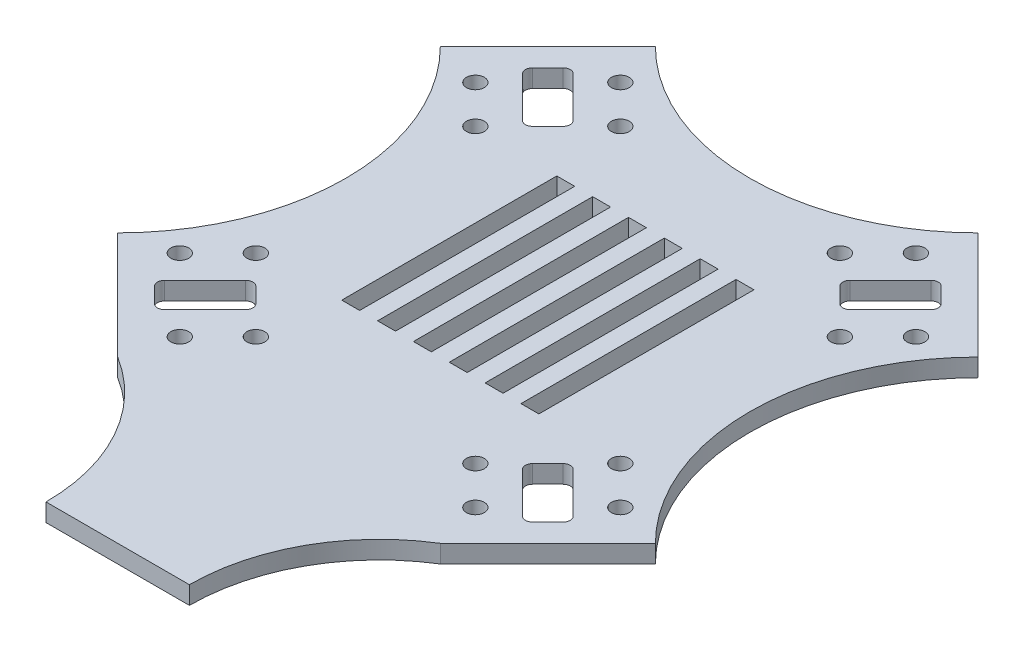
from build123d import *

# Parameters (mm, degrees)
SKETCH2_R           = 2.5
SKETCH2_W           = 5
SKETCH2_H           = 60
BOSS_EXTRUDE1_DEPTH = 5
BOSS_EXTRUDE2_DEPTH = 5


with BuildPart() as part:
    # Sketch2 → Boss-Extrude1 (new body)
    with BuildSketch(Plane(origin=(0, 0, 0), x_dir=(1, 0, 0), z_dir=(0, 1, 0))):
        with BuildLine():
            Line((45, 75), (75, 45))
            ThreePointArc((75, 45), (56.360389693, 0), (75, -45))
            Line((75, -45), (45, -75))
            ThreePointArc((45, -75), (0, -56.360389693), (-45, -75))
            Line((-45, -75), (-75, -45))
            ThreePointArc((-75, -45), (-56.360389693, 0), (-75, 45))
            Line((-75, 45), (-45, 75))
            ThreePointArc((-45, 75), (0, 56.360389693), (45, 75))
        make_face()
        with Locations(Location((50.841633347, 30.621504688, 0), (0, 0, 270))):
            Circle(SKETCH2_R, mode=Mode.SUBTRACT)
        with Locations(Location((61.448235065, 41.228106405, 0), (0, 0, 270))):
            Circle(SKETCH2_R, mode=Mode.SUBTRACT)
        with Locations(Location((30.621504688, 50.841633347, 0), (0, 0, 90))):
            Circle(SKETCH2_R, mode=Mode.SUBTRACT)
        with Locations(Location((41.228106405, 61.448235065, 0), (0, 0, 90))):
            Circle(SKETCH2_R, mode=Mode.SUBTRACT)
        with Locations(Location((30.621504688, -50.841633347, 0), (0, 0, 270))):
            Circle(SKETCH2_R, mode=Mode.SUBTRACT)
        with Locations(Location((41.228106405, -61.448235065, 0), (0, 0, 270))):
            Circle(SKETCH2_R, mode=Mode.SUBTRACT)
        with Locations(Location((61.448235065, -41.228106405, 0), (0, 0, 90))):
            Circle(SKETCH2_R, mode=Mode.SUBTRACT)
        with Locations(Location((50.841633347, -30.621504688, 0), (0, 0, 90))):
            Circle(SKETCH2_R, mode=Mode.SUBTRACT)
        with Locations(Location((-50.841633347, -30.621504688, 0), (0, 0, 270))):
            Circle(SKETCH2_R, mode=Mode.SUBTRACT)
        with Locations(Location((-61.448235065, -41.228106405, 0), (0, 0, 270))):
            Circle(SKETCH2_R, mode=Mode.SUBTRACT)
        with Locations(Location((-41.228106405, -61.448235065, 0), (0, 0, 90))):
            Circle(SKETCH2_R, mode=Mode.SUBTRACT)
        with Locations(Location((-30.621504688, -50.841633347, 0), (0, 0, 90))):
            Circle(SKETCH2_R, mode=Mode.SUBTRACT)
        with Locations(Location((-30.621504688, 50.841633347, 0), (0, 0, 270))):
            Circle(SKETCH2_R, mode=Mode.SUBTRACT)
        with Locations(Location((-41.228106405, 61.448235065, 0), (0, 0, 270))):
            Circle(SKETCH2_R, mode=Mode.SUBTRACT)
        with Locations(Location((-61.448235065, 41.228106405, 0), (0, 0, 90))):
            Circle(SKETCH2_R, mode=Mode.SUBTRACT)
        with Locations(Location((-50.841633347, 30.621504688, 0), (0, 0, 90))):
            Circle(SKETCH2_R, mode=Mode.SUBTRACT)
        with BuildLine():
            Line((38.610248674, 42.852889361), (42.852889361, 38.610248674))
            ThreePointArc((42.852889361, 38.610248674), (44.267102923, 38.024462236), (45.681316486, 38.610248674))
            Line((45.681316486, 38.610248674), (56.995024985, 49.923957173))
            ThreePointArc((56.995024985, 49.923957173), (57.580811422, 51.338170735), (56.995024985, 52.752384297))
            Line((56.995024985, 52.752384297), (52.752384297, 56.995024985))
            ThreePointArc((52.752384297, 56.995024985), (51.338170735, 57.580811422), (49.923957173, 56.995024985))
            Line((49.923957173, 56.995024985), (38.610248674, 45.681316486))
            ThreePointArc((38.610248674, 45.681316486), (38.024462236, 44.267102923), (38.610248674, 42.852889361))
        make_face(mode=Mode.SUBTRACT)
        with Locations((5, 0)):
            Rectangle(SKETCH2_W, SKETCH2_H, mode=Mode.SUBTRACT)
        with Locations((-5, 0)):
            Rectangle(SKETCH2_W, SKETCH2_H, mode=Mode.SUBTRACT)
        with BuildLine():
            Line((45.681316486, -38.610248674), (56.995024985, -49.923957173))
            ThreePointArc((56.995024985, -49.923957173), (57.580811422, -51.338170735), (56.995024985, -52.752384297))
            Line((56.995024985, -52.752384297), (52.752384297, -56.995024985))
            ThreePointArc((52.752384297, -56.995024985), (51.338170735, -57.580811422), (49.923957173, -56.995024985))
            Line((49.923957173, -56.995024985), (38.610248674, -45.681316486))
            ThreePointArc((38.610248674, -45.681316486), (38.024462236, -44.267102923), (38.610248674, -42.852889361))
            Line((38.610248674, -42.852889361), (42.852889361, -38.610248674))
            ThreePointArc((42.852889361, -38.610248674), (44.267102923, -38.024462236), (45.681316486, -38.610248674))
        make_face(mode=Mode.SUBTRACT)
        with BuildLine():
            Line((-38.610248674, -45.681316486), (-49.923957173, -56.995024985))
            ThreePointArc((-49.923957173, -56.995024985), (-51.338170735, -57.580811422), (-52.752384297, -56.995024985))
            Line((-52.752384297, -56.995024985), (-56.995024985, -52.752384297))
            ThreePointArc((-56.995024985, -52.752384297), (-57.580811422, -51.338170735), (-56.995024985, -49.923957173))
            Line((-56.995024985, -49.923957173), (-45.681316486, -38.610248674))
            ThreePointArc((-45.681316486, -38.610248674), (-44.267102923, -38.024462236), (-42.852889361, -38.610248674))
            Line((-42.852889361, -38.610248674), (-38.610248674, -42.852889361))
            ThreePointArc((-38.610248674, -42.852889361), (-38.024462236, -44.267102923), (-38.610248674, -45.681316486))
        make_face(mode=Mode.SUBTRACT)
        with BuildLine():
            Line((-45.681316486, 38.610248674), (-56.995024985, 49.923957173))
            ThreePointArc((-56.995024985, 49.923957173), (-57.580811422, 51.338170735), (-56.995024985, 52.752384297))
            Line((-56.995024985, 52.752384297), (-52.752384297, 56.995024985))
            ThreePointArc((-52.752384297, 56.995024985), (-51.338170735, 57.580811422), (-49.923957173, 56.995024985))
            Line((-49.923957173, 56.995024985), (-38.610248674, 45.681316486))
            ThreePointArc((-38.610248674, 45.681316486), (-38.024462236, 44.267102923), (-38.610248674, 42.852889361))
            Line((-38.610248674, 42.852889361), (-42.852889361, 38.610248674))
            ThreePointArc((-42.852889361, 38.610248674), (-44.267102923, 38.024462236), (-45.681316486, 38.610248674))
        make_face(mode=Mode.SUBTRACT)
        with Locations((-15, 0)):
            Rectangle(SKETCH2_W, SKETCH2_H, mode=Mode.SUBTRACT)
        with Locations((-25, 0)):
            Rectangle(SKETCH2_W, SKETCH2_H, mode=Mode.SUBTRACT)
        with Locations((15, 0)):
            Rectangle(SKETCH2_W, SKETCH2_H, mode=Mode.SUBTRACT)
        with Locations((25, 0)):
            Rectangle(SKETCH2_W, SKETCH2_H, mode=Mode.SUBTRACT)
    extrude(amount=-BOSS_EXTRUDE1_DEPTH)

    # Sketch3 → Boss-Extrude2 (add)
    with BuildSketch(Plane(origin=(0, 0, 0), x_dir=(1, 0, 0), z_dir=(0, 1, 0))):
        with BuildLine():
            Line((-20, -120), (20, -120))
            ThreePointArc((20, -120), (26.669664366, -94.260924648), (45, -75))
            ThreePointArc((45, -75), (0, -56.360389693), (-45, -75))
            ThreePointArc((-45, -75), (-26.669664366, -94.260924648), (-20, -120))
        make_face()
    extrude(amount=-BOSS_EXTRUDE2_DEPTH)


solid = part.part
